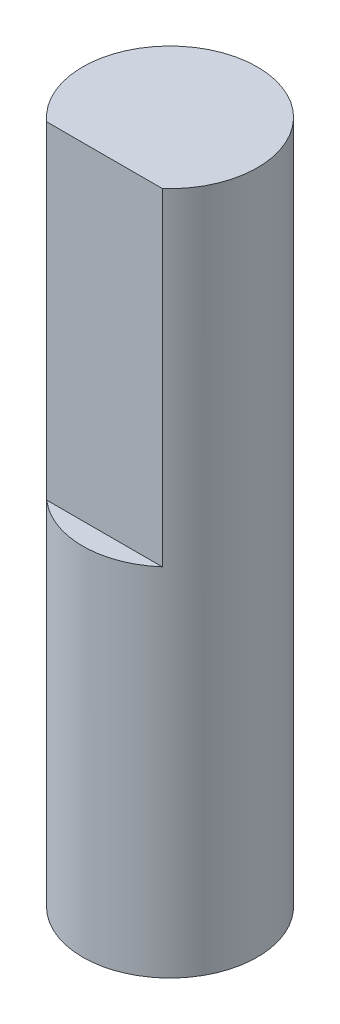
from build123d import *

# Parameters (mm, degrees)
SKETCH1_R           = 4
BOSS_EXTRUDE1_DEPTH = 31.3
CUT_EXTRUDE2_START  = -15
CUT_EXTRUDE2_DEPTH  = 15


with BuildPart() as part:
    # Sketch1 → Boss-Extrude1 (new body)
    with BuildSketch(Plane(origin=(0, 0, 0), x_dir=(1, 0, 0), z_dir=(0, 1, 0))):
        with Locations(Location((0, 0, 0), (0, 0, 270))):
            Circle(SKETCH1_R)
    extrude(amount=BOSS_EXTRUDE1_DEPTH)

    # Sketch2 → Cut-Extrude2 (cut)
    with BuildSketch(Plane(origin=(0, 31.3, 0), x_dir=(1, 0, 0), z_dir=(0, 1, 0)).offset(CUT_EXTRUDE2_START)):
        with BuildLine():
            Line((-2.645751311, -3), (2.645751311, -3))
            ThreePointArc((2.645751311, -3), (0, -4), (-2.645751311, -3))
        make_face()
    extrude(amount=CUT_EXTRUDE2_DEPTH, mode=Mode.SUBTRACT)


solid = part.part
